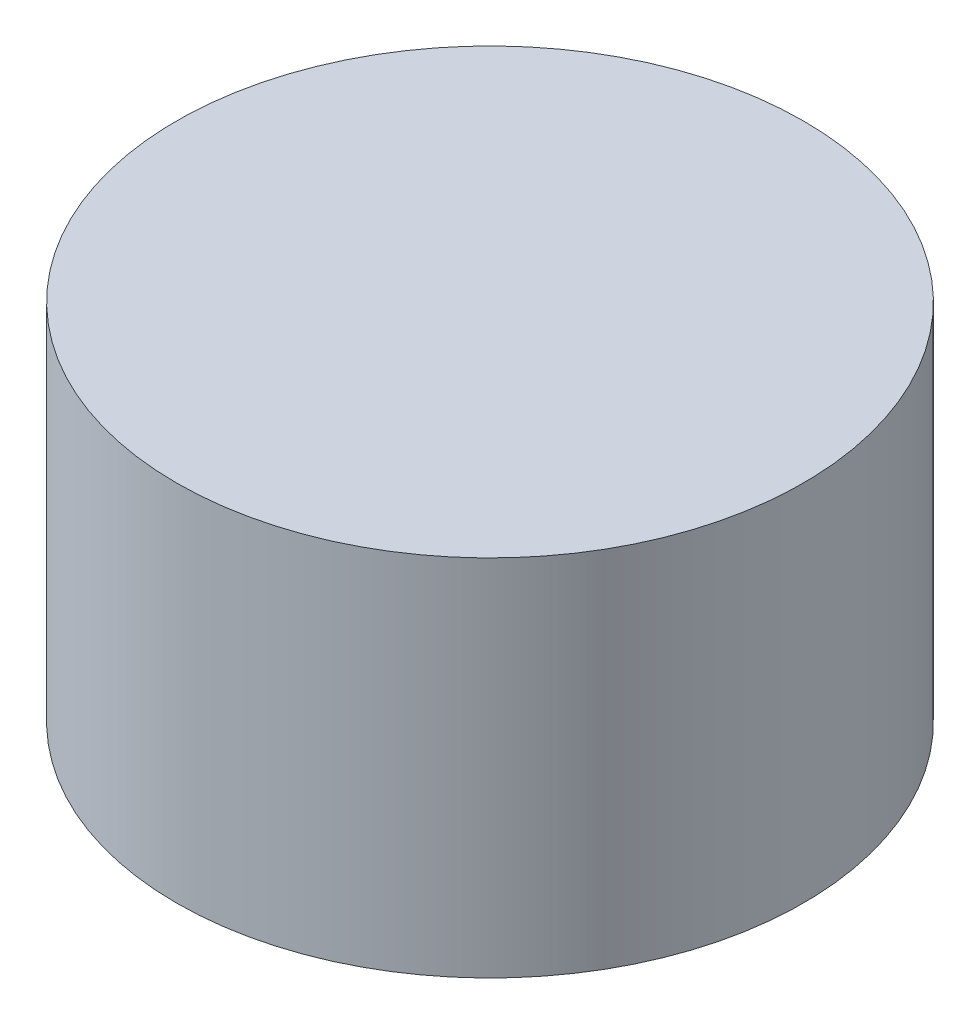
from build123d import *

# Parameters (mm, degrees)
SKETCH1_R           = 4.308872245
BOSS_EXTRUDE1_DEPTH = 5


with BuildPart() as part:
    # Sketch1 → Boss-Extrude1 (new body)
    with BuildSketch(Plane(origin=(0, 0, 0), x_dir=(1, 0, 0), z_dir=(0, 1, 0))):
        with Locations(Location((-5.754862303, 5.6416284, 0), (0, 0, 270))):
            Circle(SKETCH1_R)
    extrude(amount=BOSS_EXTRUDE1_DEPTH)


solid = part.part
